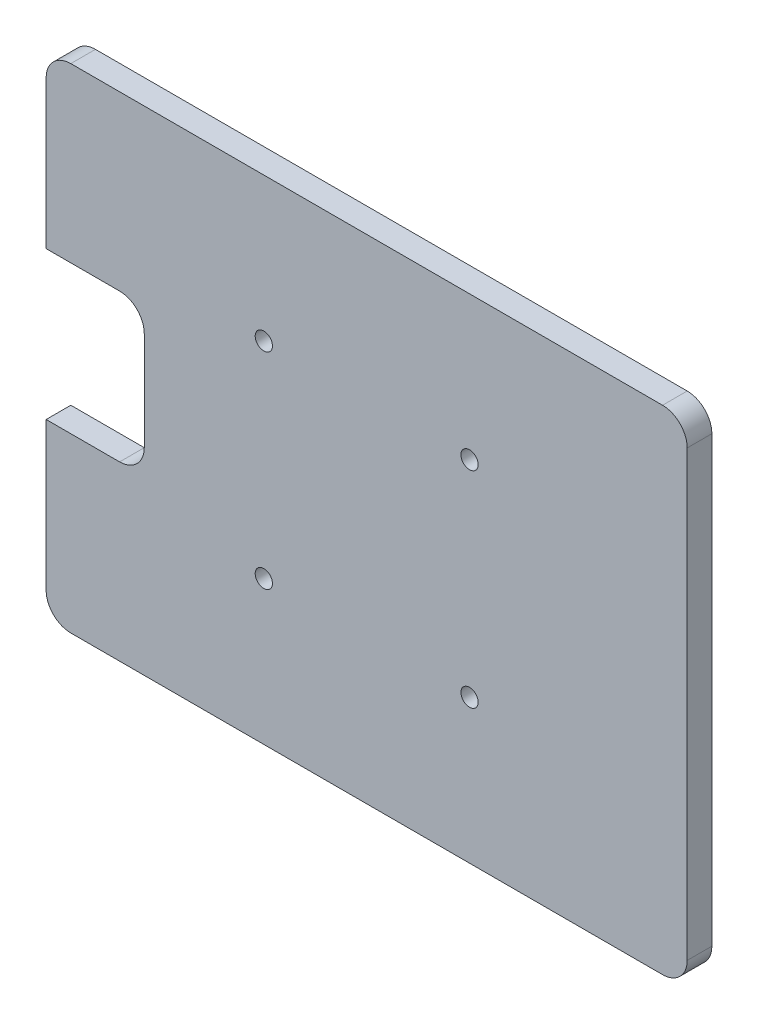
from build123d import *

# Parameters (mm, degrees)
ESQUISSE1_W             = 130
ESQUISSE1_H             = 100
BOSS_EXTRU_1_DEPTH      = 5
ESQUISSE2_R             = 1.75
ENL_V_MAT_EXTRU_1_DEPTH = 10
ESQUISSE4_W             = 19.900527691
ESQUISSE4_H             = 30
ENL_V_MAT_EXTRU_2_DEPTH = 10
CONG_1_R                = 5


with BuildPart() as part:
    # Esquisse1 → Boss.-Extru.1 (new body)
    with BuildSketch(Plane.XY):
        with Locations((-11.008064516, 2.681451613)):
            Rectangle(ESQUISSE1_W, ESQUISSE1_H)
    extrude(amount=BOSS_EXTRU_1_DEPTH)

    # Esquisse2 → Enlèv. mat.-Extru.1 (cut)
    with BuildSketch(Plane.XY.offset(5)):
        with Locations((9.851585529, -18.178198432)):
            Circle(ESQUISSE2_R)
        with Locations((-31.867714561, -18.178198432)):
            Circle(ESQUISSE2_R)
        with Locations((-31.867714561, 23.541101658)):
            Circle(ESQUISSE2_R)
        with Locations((9.851585529, 23.541101658)):
            Circle(ESQUISSE2_R)
    extrude(amount=-ENL_V_MAT_EXTRU_1_DEPTH, mode=Mode.SUBTRACT)

    # Esquisse4 → Enlèv. mat.-Extru.2 (cut)
    with BuildSketch(Plane.XY.offset(5)):
        with Locations((-66.057800671, 2.681451613)):
            Rectangle(ESQUISSE4_W, ESQUISSE4_H)
    extrude(amount=-ENL_V_MAT_EXTRU_2_DEPTH, mode=Mode.SUBTRACT)

    # Congé1
    cong_1_edges = [part.edges().sort_by_distance(p)[0] for p in [
        (-56.107536825, 17.681451613, 2.5),
        (-56.107536825, -12.318548387, 2.5),
        (-76.008064516, 52.681451613, 2.5),
        (53.991935484, 52.681451613, 2.5),
        (53.991935484, -47.318548387, 2.5),
        (-76.008064516, -47.318548387, 2.5),
    ]]
    fillet(cong_1_edges, radius=CONG_1_R)


solid = part.part
